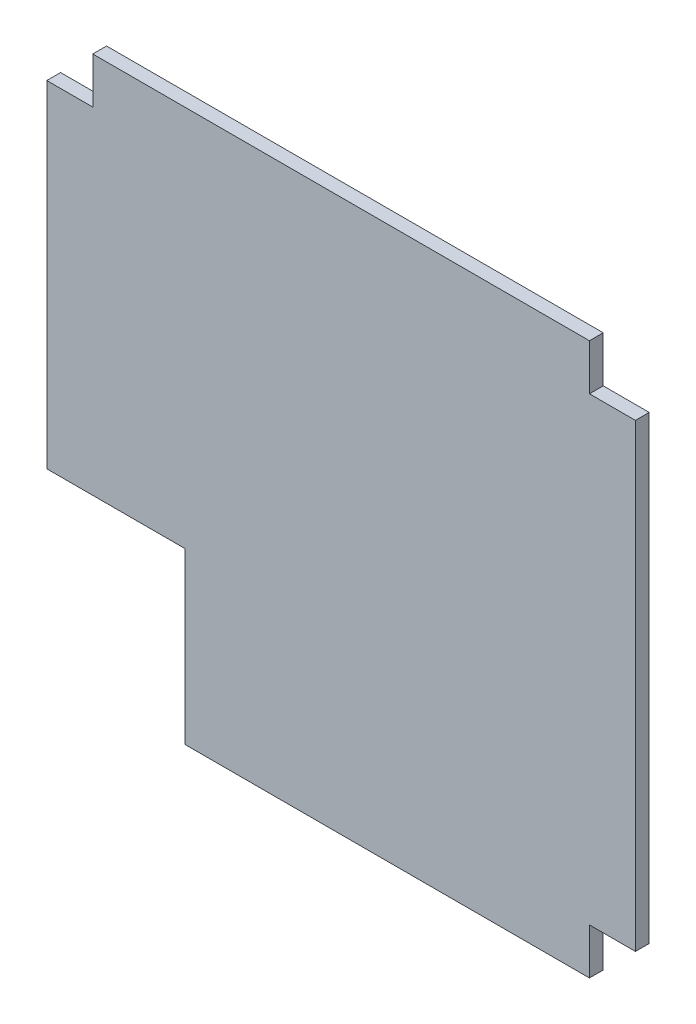
from build123d import *

# Parameters (mm, degrees)
CROQUIS1_W              = 426.64
CROQUIS1_H              = 400
SALIENTE_EXTRUIR1_DEPTH = 10
CROQUIS2_W              = 33.32
CROQUIS2_H              = 33.32
CORTAR_EXTRUIR1_DEPTH   = 393.634757764
CORTAR_EXTRUIR2_DEPTH   = 393.634757764


with BuildPart() as part:
    # Croquis1 → Saliente-Extruir1 (new body)
    with BuildSketch(Plane.XY):
        with Locations((80.724304492, -60)):
            Rectangle(CROQUIS1_W, CROQUIS1_H)
    extrude(amount=SALIENTE_EXTRUIR1_DEPTH)

    # Croquis2 → Cortar-Extruir1 (cut, through all)
    with BuildSketch(Plane.XY.offset(10)):
        with Locations((-115.935695508, -243.34)):
            Rectangle(CROQUIS2_W, CROQUIS2_H)
        with Locations((-115.935695508, 123.34)):
            Rectangle(CROQUIS2_W, CROQUIS2_H)
        with Locations((277.384304492, 123.34)):
            Rectangle(CROQUIS2_W, CROQUIS2_H)
        with Locations((277.384304492, -243.34)):
            Rectangle(CROQUIS2_W, CROQUIS2_H)
    extrude(amount=-CORTAR_EXTRUIR1_DEPTH, mode=Mode.SUBTRACT)

    # Croquis3 → Cortar-Extruir2 (cut, through all)
    with BuildSketch(Plane.XY.offset(10)):
        Polygon((-132.595695508, -137.05), (-132.595695508, -226.68), (-99.275695508, -226.68), (-99.275695508, -260), (-32.595695508, -260), (-32.595695508, -137.05), align=None)
    extrude(amount=-CORTAR_EXTRUIR2_DEPTH, mode=Mode.SUBTRACT)


solid = part.part
